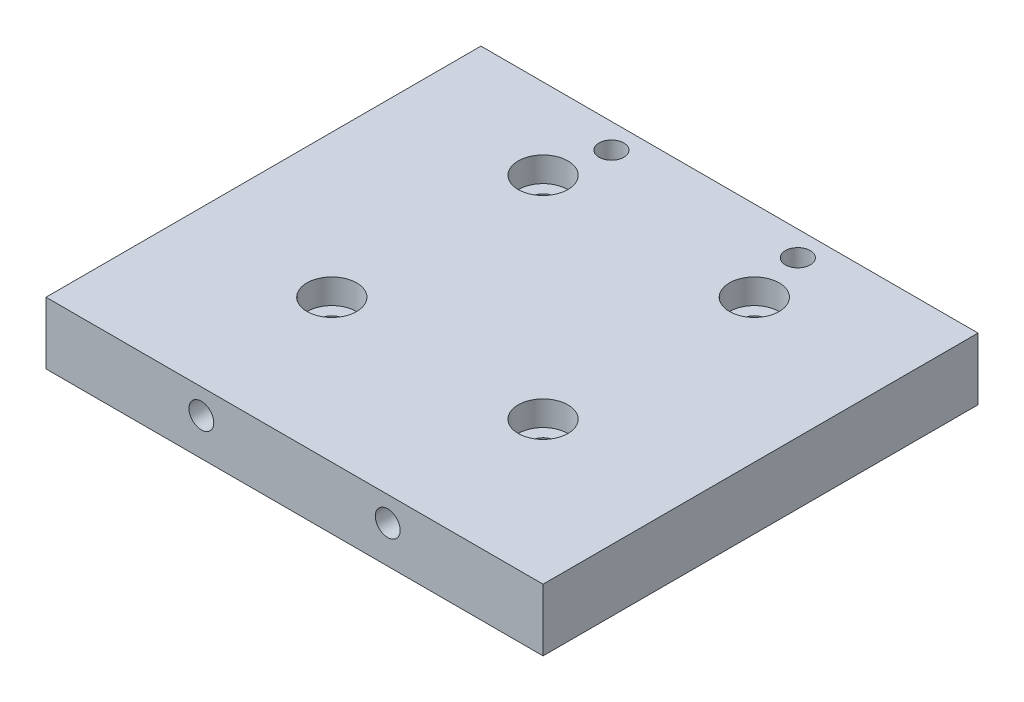
from build123d import *

# Parameters (mm, degrees)
SKETCH2_W           = 40
SKETCH2_H           = 30
SKETCH2_R           = 1
BOSS_EXTRUDE1_DEPTH = 5
SKETCH3_R           = 2
CUT_EXTRUDE1_DEPTH  = 2
SKETCH5_R           = 1
CUT_EXTRUDE2_DEPTH  = 26.495097568
SKETCH7_W           = 40
SKETCH7_H           = 5
BOSS_EXTRUDE2_DEPTH = 5
SKETCH8_R           = 1
CUT_EXTRUDE3_DEPTH  = 5


with BuildPart() as part:
    # Sketch2 → Boss-Extrude1 (new body)
    with BuildSketch(Plane(origin=(0, 0, 0), x_dir=(1, 0, 0), z_dir=(0, 1, 0))):
        Rectangle(SKETCH2_W, SKETCH2_H)
        with Locations(Location((-8.5, 8.5, 0), (0, 0, 270))):
            Circle(SKETCH2_R, mode=Mode.SUBTRACT)
        with Locations(Location((8.5, 8.5, 0), (0, 0, 270))):
            Circle(SKETCH2_R, mode=Mode.SUBTRACT)
        with Locations(Location((8.5, -8.5, 0), (0, 0, 270))):
            Circle(SKETCH2_R, mode=Mode.SUBTRACT)
        with Locations(Location((-8.5, -8.5, 0), (0, 0, 270))):
            Circle(SKETCH2_R, mode=Mode.SUBTRACT)
    extrude(amount=BOSS_EXTRUDE1_DEPTH)

    # Sketch3 → Cut-Extrude1 (cut)
    with BuildSketch(Plane(origin=(0, 5, 0), x_dir=(1, 0, 0), z_dir=(0, 1, 0))):
        with Locations(Location((-8.5, 8.5, 0), (0, 0, 270))):
            Circle(SKETCH3_R)
        with Locations(Location((8.5, 8.5, 0), (0, 0, 270))):
            Circle(SKETCH3_R)
        with Locations(Location((8.5, -8.5, 0), (0, 0, 270))):
            Circle(SKETCH3_R)
        with Locations(Location((-8.5, -8.5, 0), (0, 0, 270))):
            Circle(SKETCH3_R)
    extrude(amount=-CUT_EXTRUDE1_DEPTH, mode=Mode.SUBTRACT)

    # Sketch5 → Cut-Extrude2 (cut, through all)
    with BuildSketch(Plane.XZ):
        with Locations(Location((-7.5, -13, 0), (0, 0, 270))):
            Circle(SKETCH5_R)
        with Locations(Location((7.5, -13, 0), (0, 0, 270))):
            Circle(SKETCH5_R)
    extrude(amount=-CUT_EXTRUDE2_DEPTH, mode=Mode.SUBTRACT)

    # Sketch7 → Boss-Extrude2 (add)
    with BuildSketch(Plane.XY.offset(15)):
        with Locations((0, 2.5)):
            Rectangle(SKETCH7_W, SKETCH7_H)
    extrude(amount=BOSS_EXTRUDE2_DEPTH)

    # Sketch8 → Cut-Extrude3 (cut)
    with BuildSketch(Plane.XY.offset(20)):
        with Locations((-7.5, 3)):
            Circle(SKETCH8_R)
        with Locations((7.5, 3)):
            Circle(SKETCH8_R)
    extrude(amount=-CUT_EXTRUDE3_DEPTH, mode=Mode.SUBTRACT)


solid = part.part
